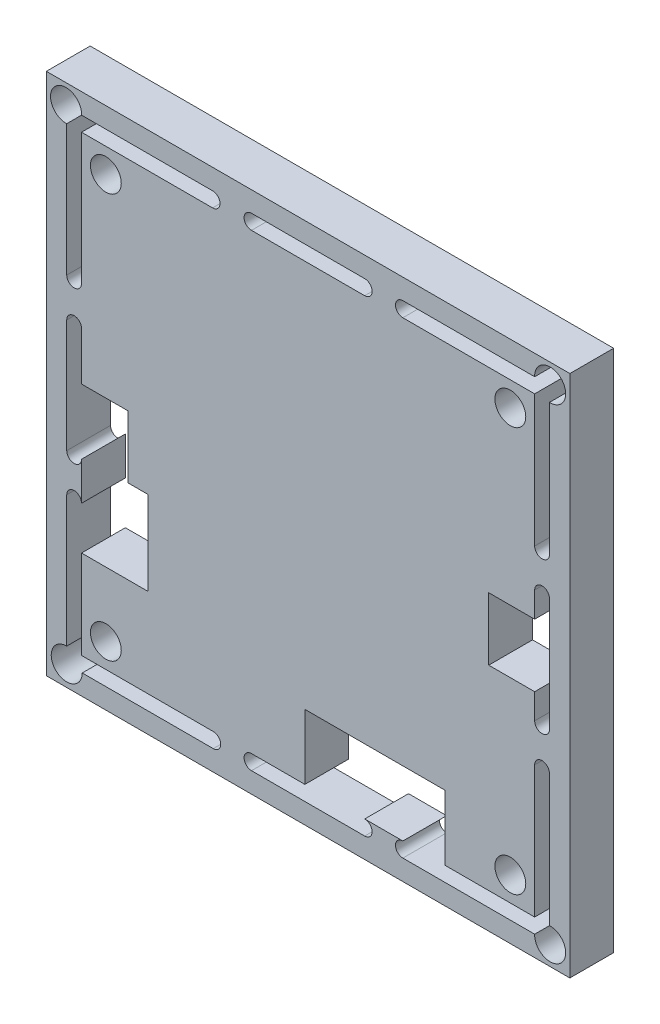
from build123d import *

# Parameters (mm, degrees)
SKETCH1_W           = 37.9349
SKETCH1_H           = 37.9349
BOSS_EXTRUDE1_DEPTH = 3.175
SKETCH9_R           = 1.1176
CUT_EXTRUDE2_DEPTH  = 3.175
SKETCH12_W          = 3.3274
SKETCH12_H          = 4.5466
CUT_EXTRUDE4_DEPTH  = 3.175
SKETCH15_W          = 3.3528
SKETCH15_H          = 4.5212
CUT_EXTRUDE3_DEPTH  = 3.175
SKETCH13_W          = 10.16
SKETCH13_H          = 4.7117
CUT_EXTRUDE5_DEPTH  = 3.175
SKETCH14_W          = 4.8006
SKETCH14_H          = 6.0833
CUT_EXTRUDE6_DEPTH  = 3.175


with BuildPart() as part:
    # Sketch1 → Boss-Extrude1 (new body)
    with BuildSketch(Plane.XY):
        with Locations((18.96745, 18.96745)):
            Rectangle(SKETCH1_W, SKETCH1_H)
    extrude(amount=BOSS_EXTRUDE1_DEPTH)

    # Sketch9 → Cut-Extrude2 (cut)
    with BuildSketch(Plane.XY.offset(3.175)):
        with Locations((33.62325, 33.62325)):
            Circle(SKETCH9_R)
        with Locations((4.31165, 33.62325)):
            Circle(SKETCH9_R)
        with Locations((4.31165, 4.31165)):
            Circle(SKETCH9_R)
        with Locations((33.62325, 4.31165)):
            Circle(SKETCH9_R)
        with BuildLine():
            Line((35.385619933, 12.100169933), (35.385619933, 2.549280067))
            Line((35.385619933, 2.549280067), (25.834730067, 2.549280067))
            ThreePointArc((25.834730067, 2.549280067), (25.2984, 2.01295), (25.834730067, 1.476619933))
            Line((25.834730067, 1.476619933), (35.385619933, 1.476619933))
            ThreePointArc((35.385619933, 1.476619933), (37.303202335, 0.631697665), (36.458280067, 2.549280067))
            Line((36.458280067, 2.549280067), (36.458280067, 12.100169933))
            ThreePointArc((36.458280067, 12.100169933), (35.92195, 12.6365), (35.385619933, 12.100169933))
        make_face()
        with BuildLine():
            Line((35.385619933, 36.458280067), (25.834730067, 36.458280067))
            ThreePointArc((25.834730067, 36.458280067), (25.2984, 35.92195), (25.834730067, 35.385619933))
            Line((25.834730067, 35.385619933), (35.385619933, 35.385619933))
            Line((35.385619933, 35.385619933), (35.385619933, 25.834730067))
            ThreePointArc((35.385619933, 25.834730067), (35.92195, 25.2984), (36.458280067, 25.834730067))
            Line((36.458280067, 25.834730067), (36.458280067, 35.385619933))
            ThreePointArc((36.458280067, 35.385619933), (37.303202335, 37.303202335), (35.385619933, 36.458280067))
        make_face()
        with BuildLine():
            Line((12.048880067, 36.458280067), (2.549280067, 36.458280067))
            ThreePointArc((2.549280067, 36.458280067), (0.631697665, 37.303202335), (1.476619933, 35.385619933))
            Line((1.476619933, 35.385619933), (1.476619933, 25.886019933))
            ThreePointArc((1.476619933, 25.886019933), (2.01295, 25.349689867), (2.549280067, 25.886019933))
            Line((2.549280067, 25.886019933), (2.549280067, 35.385619933))
            Line((2.549280067, 35.385619933), (12.048880067, 35.385619933))
            ThreePointArc((12.048880067, 35.385619933), (12.585210133, 35.92195), (12.048880067, 36.458280067))
        make_face()
        with BuildLine():
            Line((23.06955, 36.458280067), (14.86535, 36.458280067))
            ThreePointArc((14.86535, 36.458280067), (14.329019933, 35.92195), (14.86535, 35.385619933))
            Line((14.86535, 35.385619933), (23.06955, 35.385619933))
            ThreePointArc((23.06955, 35.385619933), (23.605880067, 35.92195), (23.06955, 36.458280067))
        make_face()
        with BuildLine():
            Line((2.549280067, 23.06955), (2.549280067, 14.86535))
            ThreePointArc((2.549280067, 14.86535), (2.01295, 14.329019933), (1.476619933, 14.86535))
            Line((1.476619933, 14.86535), (1.476619933, 23.06955))
            ThreePointArc((1.476619933, 23.06955), (2.01295, 23.605880067), (2.549280067, 23.06955))
        make_face()
        with BuildLine():
            Line((36.458280067, 23.06955), (36.458280067, 14.86535))
            ThreePointArc((36.458280067, 14.86535), (35.92195, 14.329019933), (35.385619933, 14.86535))
            Line((35.385619933, 14.86535), (35.385619933, 23.06955))
            ThreePointArc((35.385619933, 23.06955), (35.92195, 23.605880067), (36.458280067, 23.06955))
        make_face()
        with BuildLine():
            Line((23.06955, 2.549280067), (14.86535, 2.549280067))
            ThreePointArc((14.86535, 2.549280067), (14.329019933, 2.01295), (14.86535, 1.476619933))
            Line((14.86535, 1.476619933), (23.06955, 1.476619933))
            ThreePointArc((23.06955, 1.476619933), (23.605880067, 2.01295), (23.06955, 2.549280067))
        make_face()
        with BuildLine():
            Line((2.549280067, 12.100169933), (2.549280067, 2.549280067))
            Line((2.549280067, 2.549280067), (12.100169933, 2.549280067))
            ThreePointArc((12.100169933, 2.549280067), (12.6365, 2.01295), (12.100169933, 1.476619933))
            Line((12.100169933, 1.476619933), (2.600569933, 1.476619933))
            ThreePointArc((2.600569933, 1.476619933), (0.681867267, 0.681867267), (1.476619933, 2.600569933))
            Line((1.476619933, 2.600569933), (1.476619933, 12.100169933))
            ThreePointArc((1.476619933, 12.100169933), (2.01295, 12.6365), (2.549280067, 12.100169933))
        make_face()
    extrude(amount=-CUT_EXTRUDE2_DEPTH, mode=Mode.SUBTRACT)

    # Sketch12 → Cut-Extrude4 (cut)
    with BuildSketch(Plane(origin=(0, 0, 0), x_dir=(-1, 0, 0), z_dir=(0, 0, -1))):
        with Locations((-33.721919933, 18.96745)):
            Rectangle(SKETCH12_W, SKETCH12_H)
    extrude(amount=-CUT_EXTRUDE4_DEPTH, mode=Mode.SUBTRACT)

    # Sketch15 → Cut-Extrude3 (cut)
    with BuildSketch(Plane(origin=(0, 0, 0), x_dir=(-1, 0, 0), z_dir=(0, 0, -1))):
        with Locations((-4.225680067, 17.3228)):
            Rectangle(SKETCH15_W, SKETCH15_H)
    extrude(amount=-CUT_EXTRUDE3_DEPTH, mode=Mode.SUBTRACT)

    # Sketch13 → Cut-Extrude5 (cut)
    with BuildSketch(Plane(origin=(0, 0, 0), x_dir=(-1, 0, 0), z_dir=(0, 0, -1))):
        with Locations((-23.8125, 4.905130067)):
            Rectangle(SKETCH13_W, SKETCH13_H)
    extrude(amount=-CUT_EXTRUDE5_DEPTH, mode=Mode.SUBTRACT)

    # Sketch14 → Cut-Extrude6 (cut)
    with BuildSketch(Plane(origin=(0, 0, 0), x_dir=(-1, 0, 0), z_dir=(0, 0, -1))):
        with Locations((-4.949580067, 12.02055)):
            Rectangle(SKETCH14_W, SKETCH14_H)
    extrude(amount=-CUT_EXTRUDE6_DEPTH, mode=Mode.SUBTRACT)


solid = part.part
